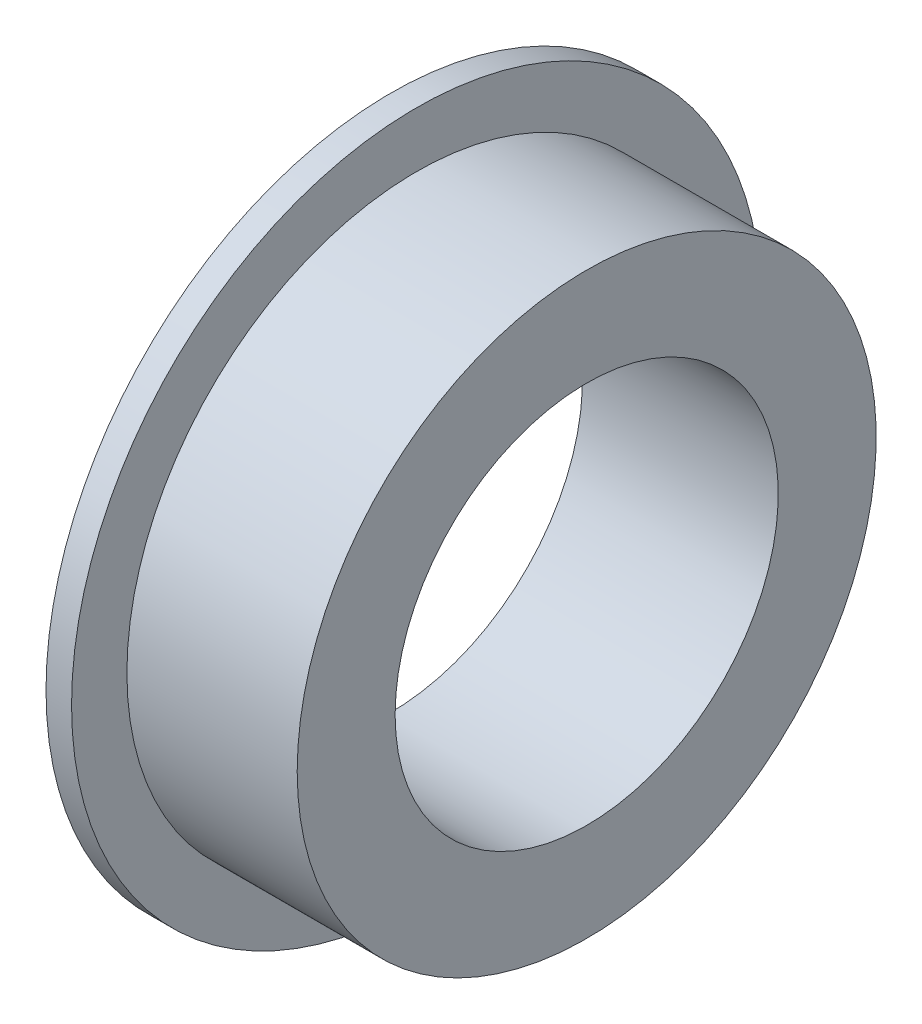
from build123d import *


with BuildPart() as part:
    # Sketch1 → Revolve1 (revolve)
    with BuildSketch(Plane.XY, mode=Mode.PRIVATE) as revolve1_sk:
        Polygon((0, 4.05), (0.3, 4.05), (0.3, 3.4), (2.3, 3.4), (2.3, 2.25), (0, 2.25), align=None)
    revolve(revolve1_sk.sketch.rotate(Axis((0, 0, 0), (1, 0, 0)), 90), axis=Axis((0, 0, 0), (1, 0, 0)))


solid = part.part
